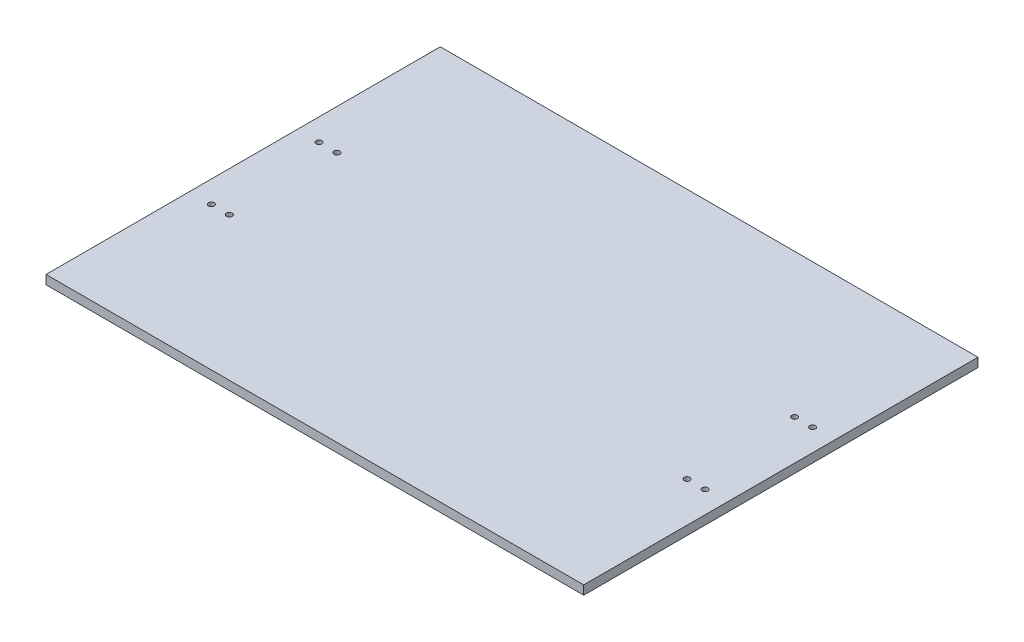
from build123d import *

# Parameters (mm, degrees)
SKETCH1_W           = 300
SKETCH1_H           = 220
BOSS_EXTRUDE1_DEPTH = 5
SKETCH2_R           = 1.6
CUT_EXTRUDE1_DEPTH  = 10


with BuildPart() as part:
    # Sketch1 → Boss-Extrude1 (new body)
    with BuildSketch(Plane(origin=(0, 0, 0), x_dir=(1, 0, 0), z_dir=(0, 1, 0))):
        Rectangle(SKETCH1_W, SKETCH1_H)
    extrude(amount=BOSS_EXTRUDE1_DEPTH)

    # Sketch2 → Cut-Extrude1 (cut)
    with BuildSketch(Plane.XZ):
        with Locations(Location((-137.7, -30, 0), (0, 0, 270))):
            Circle(SKETCH2_R)
        with Locations(Location((-127.7, -30, 0), (0, 0, 270))):
            Circle(SKETCH2_R)
        with Locations(Location((-137.7, 30, 0), (0, 0, 270))):
            Circle(SKETCH2_R)
        with Locations(Location((-127.7, 30, 0), (0, 0, 270))):
            Circle(SKETCH2_R)
        with Locations(Location((137.7, 30, 0), (0, 0, 270))):
            Circle(SKETCH2_R)
        with Locations(Location((137.7, -30, 0), (0, 0, 270))):
            Circle(SKETCH2_R)
        with Locations(Location((127.7, -30, 0), (0, 0, 270))):
            Circle(SKETCH2_R)
        with Locations(Location((127.7, 30, 0), (0, 0, 270))):
            Circle(SKETCH2_R)
    extrude(amount=-CUT_EXTRUDE1_DEPTH, mode=Mode.SUBTRACT)


solid = part.part
